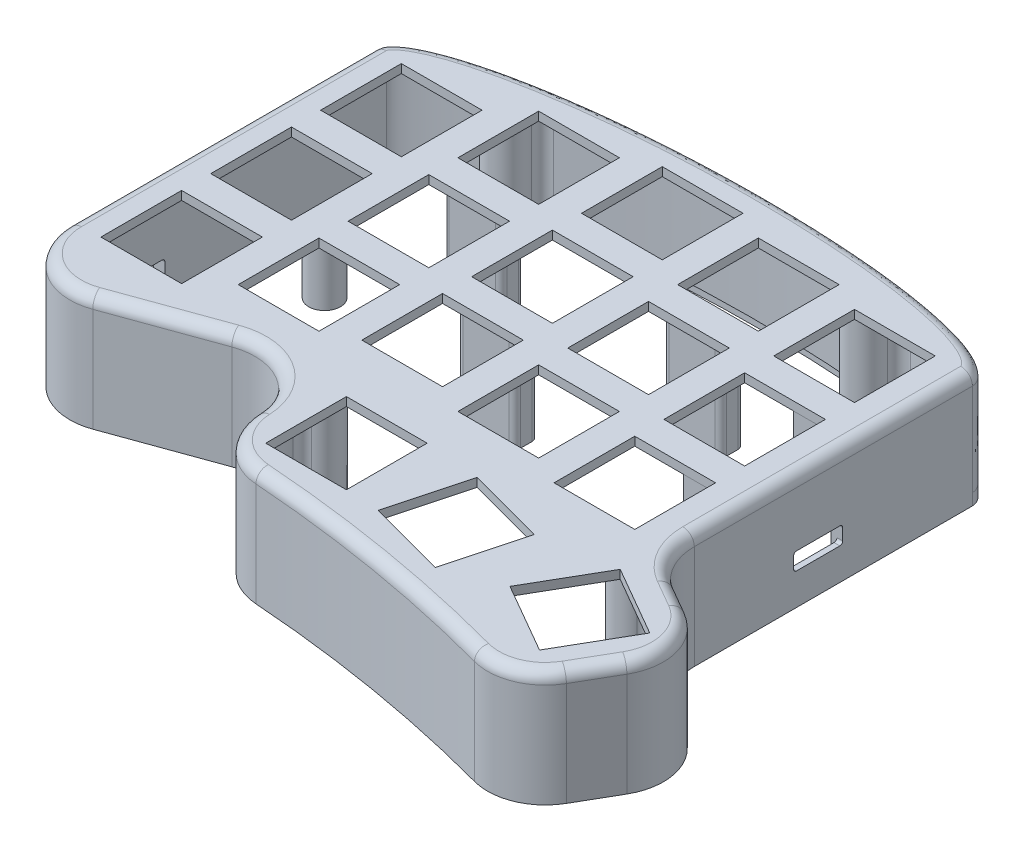
from build123d import *

# Parameters (mm, degrees)
SKETCH2_W           = 14
SKETCH2_H           = 14
BOSS_EXTRUDE1_DEPTH = 18
CUT_EXTRUDE1_START  = -18
CUT_EXTRUDE1_DEPTH  = 16.5
FILLET2_R           = 2
BOSS_EXTRUDE2_START = -18
SKETCH5_R           = 3.25
SKETCH5_R_2         = 1.75
BOSS_EXTRUDE2_DEPTH = 16.5
BOSS_EXTRUDE3_START = -18
BOSS_EXTRUDE3_DEPTH = 2
BOSS_EXTRUDE4_START = -1.5
SKETCH10_R          = 1.75
BOSS_EXTRUDE4_DEPTH = 9.5
SKETCH11_W          = 4.25
SKETCH11_H          = 3
CUT_EXTRUDE6_DEPTH  = 3
CUT_EXTRUDE7_START  = -1
SKETCH11_3_W        = 8.5
SKETCH11_3_H        = 3
CUT_EXTRUDE7_DEPTH  = 3
FILLET4_R           = 0.5
SKETCH12_W          = 8.5
SKETCH12_H          = 3
CUT_EXTRUDE8_DEPTH  = 3
CUT_EXTRUDE9_START  = -1
SKETCH12_3_W        = 8.5
SKETCH12_3_H        = 3.5
CUT_EXTRUDE9_DEPTH  = 3
FILLET5_R           = 0.5


with BuildPart() as part:
    # Sketch2 → Boss-Extrude1 (new body)
    with BuildSketch(Plane(origin=(0, 0, 0), x_dir=(1, 0, 0), z_dir=(0, 1, 0))):
        with BuildLine():
            add(Edge.make_bspline(
                [(-1.5375, 69.612480116), (-1.790942417, 79.920306638), (-52.3875, 78.67627), (-102.984057583, 77.432233362), (-102.730615166, 67.124406841)],
                knots=[0, 0, 0, 1.570796327, 1.570796327, 3.141592654, 3.141592654, 3.141592654], degree=2, weights=[1, 0.707106781, 1, 0.707106781, 1]))
            Line((-102.730615166, 67.124406841), (-102.730615166, 14.278708172))
            ThreePointArc((-102.730615166, 14.278708172), (-98.474805683, 6.093094249), (-89.329760106, 4.874762997))
            Line((-89.329760106, 4.874762997), (-71.623538294, 11.278064263))
            ThreePointArc((-71.623538294, 11.278064263), (-62.662017888, 10.185496887), (-58.232581617, 2.318944544))
            ThreePointArc((-58.232581617, 2.318944544), (-55.406952026, -4.212643161), (-48.952816792, -7.210969177))
            ThreePointArc((-48.952816792, -7.210969177), (-25.961626357, -9.967323639), (-3.342724336, -14.924903587))
            ThreePointArc((-3.342724336, -14.924903587), (3.08385675, -14.514110281), (7.927445634, -10.270368735))
            Line((7.927445634, -10.270368735), (11.767711035, -3.617108928))
            ThreePointArc((11.767711035, -3.617108928), (12.76586328, 3.97119364), (8.105923298, 10.042734064))
            Line((8.105923298, 10.042734064), (3.463472373, 12.722359418))
            ThreePointArc((3.463472373, 12.722359418), (-0.197473334, 16.38268862), (-1.5375, 21.383174783))
            Line((-1.5375, 21.383174783), (-1.5375, 69.612480116))
        make_face()
        with Locations((-45.24248, 4.76377)):
            Rectangle(SKETCH2_W, SKETCH2_H, mode=Mode.SUBTRACT)
        with Locations((-90.4875, 21.43125)):
            Rectangle(SKETCH2_W, SKETCH2_H, mode=Mode.SUBTRACT)
        with Locations((-71.4375, 26.19375)):
            Rectangle(SKETCH2_W, SKETCH2_H, mode=Mode.SUBTRACT)
        with Locations((-52.3875, 28.57627)):
            Rectangle(SKETCH2_W, SKETCH2_H, mode=Mode.SUBTRACT)
        Polygon((-18.864086352, -6.192734043), (-32.386484043, -2.567163648), (-28.760913648, 10.955234043), (-15.238515957, 7.329663648), align=None, mode=Mode.SUBTRACT)
        Polygon((9.561890094, 2.563251416), (2.563251416, -9.561890094), (-9.561890094, -2.563251416), (-2.563251416, 9.561890094), align=None, mode=Mode.SUBTRACT)
        with Locations((-33.3375, 26.19375)):
            Rectangle(SKETCH2_W, SKETCH2_H, mode=Mode.SUBTRACT)
        with Locations((-14.2875, 23.81377)):
            Rectangle(SKETCH2_W, SKETCH2_H, mode=Mode.SUBTRACT)
        with Locations((-90.4875, 40.48125)):
            Rectangle(SKETCH2_W, SKETCH2_H, mode=Mode.SUBTRACT)
        with Locations((-71.4375, 45.24375)):
            Rectangle(SKETCH2_W, SKETCH2_H, mode=Mode.SUBTRACT)
        with Locations((-52.3875, 47.62627)):
            Rectangle(SKETCH2_W, SKETCH2_H, mode=Mode.SUBTRACT)
        with Locations((-90.4875, 59.53125)):
            Rectangle(SKETCH2_W, SKETCH2_H, mode=Mode.SUBTRACT)
        with Locations((-71.4375, 64.29375)):
            Rectangle(SKETCH2_W, SKETCH2_H, mode=Mode.SUBTRACT)
        with Locations((-52.3875, 66.67627)):
            Rectangle(SKETCH2_W, SKETCH2_H, mode=Mode.SUBTRACT)
        with Locations((-33.3375, 45.24375)):
            Rectangle(SKETCH2_W, SKETCH2_H, mode=Mode.SUBTRACT)
        with Locations((-14.2875, 42.86377)):
            Rectangle(SKETCH2_W, SKETCH2_H, mode=Mode.SUBTRACT)
        with Locations((-33.3375, 64.29375)):
            Rectangle(SKETCH2_W, SKETCH2_H, mode=Mode.SUBTRACT)
        with Locations((-14.2875, 61.91377)):
            Rectangle(SKETCH2_W, SKETCH2_H, mode=Mode.SUBTRACT)
    extrude(amount=-BOSS_EXTRUDE1_DEPTH)

    # Sketch3 → Cut-Extrude1 (cut)
    with BuildSketch(Plane(origin=(0, 0, 0), x_dir=(1, 0, 0), z_dir=(0, 1, 0)).offset(CUT_EXTRUDE1_START)):
        with BuildLine():
            Line((-3.5375, 21.383174783), (-3.5375, 69.572252231))
            add(Edge.make_bspline(
                [(-3.5375, 69.572252231), (-3.541173709, 69.606197357), (-3.554301601, 69.637518494), (-3.581974976, 69.69884299), (-3.59790109, 69.728184635), (-3.649208348, 69.813979148), (-3.688170843, 69.868168455), (-3.813161744, 70.025614685), (-3.90522549, 70.121181493), (-4.194279123, 70.393030468), (-4.405585706, 70.554931133), (-5.061372746, 71.006569742), (-5.522514638, 71.25902), (-6.466097746, 71.720662819), (-6.949517754, 71.92786751), (-7.931027893, 72.312482719), (-8.428830807, 72.489345777), (-9.926006799, 72.983364256), (-10.934004841, 73.266597108), (-12.96190189, 73.777521594), (-13.981961729, 74.004462636), (-17.055148449, 74.624581789), (-19.121068571, 74.958054476), (-22.23625013, 75.382185792), (-23.277693249, 75.510435203), (-25.358022073, 75.743722396), (-26.39791203, 75.848886999), (-31.596167021, 76.324738014), (-35.751054647, 76.549982719), (-44.055510634, 76.777995247), (-52.354550241, 76.779469056), (-60.643745607, 76.369209951), (-68.927521195, 75.732270067), (-73.066747928, 75.302501914), (-79.270004826, 74.424333703), (-81.339635416, 74.091664857), (-85.461891203, 73.321364552), (-87.514071488, 72.885141758), (-90.562566461, 72.110499889), (-91.57329427, 71.832096728), (-93.57938348, 71.218232259), (-94.573305027, 70.883949605), (-96.040749334, 70.31553203), (-96.525188662, 70.115027036), (-97.480793406, 69.682916814), (-97.952079847, 69.451604933), (-98.868980609, 68.942188708), (-99.31665083, 68.665028512), (-99.939326788, 68.184144678), (-100.139184116, 68.012869641), (-100.410015865, 67.727114834), (-100.495516055, 67.627114913), (-100.608228775, 67.465419655), (-100.643137924, 67.409749415), (-100.687729415, 67.321804673), (-100.701248617, 67.291904033), (-100.723269859, 67.229917254), (-100.73418758, 67.197643884), (-100.730615166, 67.164634727)],
                knots=[0, 0, 0, 0, 0.000976562, 0.000976562, 0.001953125, 0.001953125, 0.00390625, 0.00390625, 0.0078125, 0.0078125, 0.015625, 0.015625, 0.03125, 0.03125, 0.046875, 0.046875, 0.0625, 0.0625, 0.09375, 0.09375, 0.125, 0.125, 0.1875, 0.1875, 0.21875, 0.21875, 0.25, 0.25, 0.375, 0.375, 0.5, 0.625, 0.625, 0.75, 0.75, 0.8125, 0.8125, 0.875, 0.875, 0.90625, 0.90625, 0.9375, 0.9375, 0.953125, 0.953125, 0.96875, 0.96875, 0.984375, 0.984375, 0.9921875, 0.9921875, 0.99609375, 0.99609375, 0.998046875, 0.998046875, 0.999023438, 0.999023438, 1, 1, 1, 1], degree=3))
            Line((-100.730615166, 67.164634727), (-100.730615166, 14.278708172))
            ThreePointArc((-100.730615166, 14.278708172), (-97.32596758, 7.730217034), (-90.009931118, 6.755552032))
            Line((-90.009931118, 6.755552032), (-72.303709306, 13.158853298))
            ThreePointArc((-72.303709306, 13.158853298), (-61.549884819, 11.847772447), (-56.234561293, 2.407909635))
            ThreePointArc((-56.234561293, 2.407909635), (-53.974057621, -2.817360528), (-48.810749433, -5.216021341))
            ThreePointArc((-48.810749433, -5.216021341), (-25.62810716, -7.99532847), (-2.820853415, -12.994191091))
            ThreePointArc((-2.820853415, -12.994191091), (2.320411453, -12.665556447), (6.195282561, -9.27056321))
            Line((6.195282561, -9.27056321), (10.035547962, -2.617303402))
            ThreePointArc((10.035547962, -2.617303402), (10.834069758, 3.453338652), (7.106117772, 8.310570991))
            Line((7.106117772, 8.310570991), (2.463666847, 10.990196345))
            ThreePointArc((2.463666847, 10.990196345), (-1.929468, 15.382591388), (-3.5375, 21.383174783))
        make_face()
        with BuildLine():
            Line((-75.4375, 52.76875), (-67.4375, 52.76875))
            ThreePointArc((-67.4375, 52.76875), (-66.730393219, 53.061643219), (-66.4375, 53.76875))
            Line((-66.4375, 53.76875), (-66.4375, 55.76875))
            ThreePointArc((-66.4375, 55.76875), (-66.730393219, 56.475856781), (-67.4375, 56.76875))
            Line((-67.4375, 56.76875), (-75.4375, 56.76875))
            ThreePointArc((-75.4375, 56.76875), (-76.144606781, 56.475856781), (-76.4375, 55.76875))
            Line((-76.4375, 55.76875), (-76.4375, 53.76875))
            ThreePointArc((-76.4375, 53.76875), (-76.144606781, 53.061643219), (-75.4375, 52.76875))
        make_face(mode=Mode.SUBTRACT)
        with BuildLine():
            Line((-56.3875, 36.10127), (-48.3875, 36.10127))
            ThreePointArc((-48.3875, 36.10127), (-47.680393219, 36.394163219), (-47.3875, 37.10127))
            Line((-47.3875, 37.10127), (-47.3875, 39.10127))
            ThreePointArc((-47.3875, 39.10127), (-47.680393219, 39.808376781), (-48.3875, 40.10127))
            Line((-48.3875, 40.10127), (-56.3875, 40.10127))
            ThreePointArc((-56.3875, 40.10127), (-57.094606781, 39.808376781), (-57.3875, 39.10127))
            Line((-57.3875, 39.10127), (-57.3875, 37.10127))
            ThreePointArc((-57.3875, 37.10127), (-57.094606781, 36.394163219), (-56.3875, 36.10127))
        make_face(mode=Mode.SUBTRACT)
        with BuildLine():
            Line((-37.3375, 52.76875), (-29.3375, 52.76875))
            ThreePointArc((-29.3375, 52.76875), (-28.630393219, 53.061643219), (-28.3375, 53.76875))
            Line((-28.3375, 53.76875), (-28.3375, 55.76875))
            ThreePointArc((-28.3375, 55.76875), (-28.630393219, 56.475856781), (-29.3375, 56.76875))
            Line((-29.3375, 56.76875), (-37.3375, 56.76875))
            ThreePointArc((-37.3375, 56.76875), (-38.044606781, 56.475856781), (-38.3375, 55.76875))
            Line((-38.3375, 55.76875), (-38.3375, 53.76875))
            ThreePointArc((-38.3375, 53.76875), (-38.044606781, 53.061643219), (-37.3375, 52.76875))
        make_face(mode=Mode.SUBTRACT)
    extrude(amount=CUT_EXTRUDE1_DEPTH, mode=Mode.SUBTRACT)

    # Fillet2
    fillet2_edges = [part.edges().sort_by_distance(p)[0] for p in [
        (-0.197473334, 0, -16.38268862),
        (5.784697835, 0, -11.382546741),
        (12.76586328, 0, -3.97119364),
        (9.847578335, 0, 6.943738831),
        (3.08385675, 0, 14.514110281),
        (-25.961626357, 0, 9.967323639),
        (-55.406952026, 0, 4.212643161),
        (-62.662017888, 0, -10.185496887),
        (-80.4766492, 0, -8.07641363),
        (-98.474805683, 0, -6.093094249),
        (-102.730615166, 0, -40.701557507),
        (-52.3875, 0, -78.67627),
        (-1.5375, 0, -45.49782745),
    ]]
    fillet(fillet2_edges, radius=FILLET2_R)

    # Sketch5 → Boss-Extrude2 (add)
    # profile 1 of 18: a face of its own
    with BuildSketch(Plane(origin=(0, 0, 0), x_dir=(1, 0, 0), z_dir=(0, 1, 0)).offset(BOSS_EXTRUDE2_START)):
        with Locations((-22.5375, 72.139784762)):
            Circle(SKETCH5_R)
        with Locations(Location((-22.5375, 72.139784762, 0), (0, 0, 270))):
            Circle(SKETCH5_R_2, mode=Mode.SUBTRACT)
    # profile 2 of 18: a face of its own
    with BuildSketch(Plane(origin=(0, 0, 0), x_dir=(1, 0, 0), z_dir=(0, 1, 0)).offset(BOSS_EXTRUDE2_START)):
        with BuildLine():
            ThreePointArc((-19.32695492, 72.64466127), (-18.825675207, 74.163836795), (-17.298656746, 74.64069133))
            add(Edge.make_bspline(
                [(-17.298656746, 74.64069133), (-18.593067242, 74.865571139), (-19.893317721, 75.063196036), (-21.505995848, 75.282761825), (-21.814403933, 75.323558959), (-22.122967436, 75.363239858)],
                knots=[0.148240494, 0.148240494, 0.148240494, 0.148240494, 0.1875, 0.1875, 0.196773323, 0.196773323, 0.196773323, 0.196773323], degree=3))
            ThreePointArc((-22.122967436, 75.363239858), (-20.271895364, 74.46992116), (-19.32695492, 72.64466127))
        make_face()
    # profile 3 of 18: a face of its own
    with BuildSketch(Plane(origin=(0, 0, 0), x_dir=(1, 0, 0), z_dir=(0, 1, 0)).offset(BOSS_EXTRUDE2_START)):
        with BuildLine():
            ThreePointArc((-25.51147163, 73.450506985), (-24.135097836, 74.970011106), (-22.122967436, 75.363239858))
            add(Edge.make_bspline(
                [(-22.122967436, 75.363239858), (-22.854226388, 75.457278888), (-23.586358227, 75.545048763), (-25.19477661, 75.725416119), (-26.071500491, 75.81559478), (-26.948050573, 75.898504353)],
                knots=[0.196773323, 0.196773323, 0.196773323, 0.196773323, 0.21875, 0.21875, 0.245095563, 0.245095563, 0.245095563, 0.245095563], degree=3))
            ThreePointArc((-26.948050573, 75.898504353), (-25.818452477, 75.334014883), (-25.362840985, 74.156280452))
            ThreePointArc((-25.362840985, 74.156280452), (-25.400401735, 73.795653479), (-25.51147163, 73.450506985))
        make_face()
    # profile 4 of 18: a face of its own
    with BuildSketch(Plane(origin=(0, 0, 0), x_dir=(1, 0, 0), z_dir=(0, 1, 0)).offset(BOSS_EXTRUDE2_START)):
        with Locations((-83.230615166, 70.431268908)):
            Circle(SKETCH5_R)
        with Locations(Location((-83.230615166, 70.431268908, 0), (0, 0, 270))):
            Circle(SKETCH5_R_2, mode=Mode.SUBTRACT)
    # profile 5 of 18: a face of its own
    with BuildSketch(Plane(origin=(0, 0, 0), x_dir=(1, 0, 0), z_dir=(0, 1, 0)).offset(BOSS_EXTRUDE2_START)):
        with BuildLine():
            add(Edge.make_bspline(
                [(-83.839020957, 73.623813723), (-85.440297336, 73.318657168), (-87.035699178, 72.98138718), (-88.620104302, 72.598317068)],
                knots=[0.816931195, 0.816931195, 0.816931195, 0.816931195, 0.865518224, 0.865518224, 0.865518224, 0.865518224], degree=3))
            ThreePointArc((-88.620104302, 72.598317068), (-87.126534585, 72.272499833), (-86.458846766, 70.897326992))
            ThreePointArc((-86.458846766, 70.897326992), (-86.460752534, 70.815677999), (-86.466465689, 70.73420684))
            ThreePointArc((-86.466465689, 70.73420684), (-85.635201125, 72.617696671), (-83.839020957, 73.623813723))
        make_face()
    # profile 6 of 18: a face of its own
    with BuildSketch(Plane(origin=(0, 0, 0), x_dir=(1, 0, 0), z_dir=(0, 1, 0)).offset(BOSS_EXTRUDE2_START)):
        with BuildLine():
            add(Edge.make_bspline(
                [(-79.048332746, 74.444805628), (-80.500939652, 74.221707486), (-81.952949176, 73.977058728), (-83.546895464, 73.679207897), (-83.692982641, 73.651644364), (-83.839020957, 73.623813723)],
                knots=[0.768597638, 0.768597638, 0.768597638, 0.768597638, 0.8125, 0.8125, 0.816931195, 0.816931195, 0.816931195, 0.816931195], degree=3))
            ThreePointArc((-83.839020957, 73.623813723), (-81.80509341, 73.351951657), (-80.339454109, 71.915751222))
            ThreePointArc((-80.339454109, 71.915751222), (-80.3413115, 73.510795358), (-79.048332746, 74.444805628))
        make_face()
    # profile 7 of 18: a face of its own
    with BuildSketch(Plane(origin=(0, 0, 0), x_dir=(1, 0, 0), z_dir=(0, 1, 0)).offset(BOSS_EXTRUDE2_START)):
        with Locations((-93.230615166, 9.555097265)):
            Circle(SKETCH5_R)
        with Locations(Location((-93.230615166, 9.555097265, 0), (0, 0, 270))):
            Circle(SKETCH5_R_2, mode=Mode.SUBTRACT)
    # profile 8 of 18: a face of its own
    with BuildSketch(Plane(origin=(0, 0, 0), x_dir=(1, 0, 0), z_dir=(0, 1, 0)).offset(BOSS_EXTRUDE2_START)):
        with BuildLine():
            ThreePointArc((-96.349172674, 10.470028447), (-97.789489932, 9.229067802), (-99.511774589, 10.03419679))
            ThreePointArc((-99.511774589, 10.03419679), (-96.969896133, 7.494277696), (-93.572720546, 6.323152973))
            ThreePointArc((-93.572720546, 6.323152973), (-95.931206019, 7.746974193), (-96.349172674, 10.470028447))
        make_face()
    # profile 9 of 18: a face of its own
    with BuildSketch(Plane(origin=(0, 0, 0), x_dir=(1, 0, 0), z_dir=(0, 1, 0)).offset(BOSS_EXTRUDE2_START)):
        with BuildLine():
            ThreePointArc((-89.986407024, 9.361155177), (-91.129921362, 7.075261476), (-93.572720546, 6.323152973))
            ThreePointArc((-93.572720546, 6.323152973), (-91.766765235, 6.33698334), (-90.009931118, 6.755552032))
            Line((-90.009931118, 6.755552032), (-87.644376011, 7.611034482))
            ThreePointArc((-87.644376011, 7.611034482), (-89.287071435, 7.85488751), (-89.986407024, 9.361155177))
        make_face()
    # profile 10 of 18: a face of its own
    with BuildSketch(Plane(origin=(0, 0, 0), x_dir=(1, 0, 0), z_dir=(0, 1, 0)).offset(BOSS_EXTRUDE2_START)):
        with Locations((-58.730615166, 13.809911638)):
            Circle(SKETCH5_R)
        with Locations(Location((-58.730615166, 13.809911638, 0), (0, 0, 270))):
            Circle(SKETCH5_R_2, mode=Mode.SUBTRACT)
    # profile 11 of 18: a face of its own
    with BuildSketch(Plane(origin=(0, 0, 0), x_dir=(1, 0, 0), z_dir=(0, 1, 0)).offset(BOSS_EXTRUDE2_START)):
        with BuildLine():
            ThreePointArc((-61.911902321, 14.474676286), (-62.767656013, 13.306970211), (-64.210075119, 13.183362038))
            ThreePointArc((-64.210075119, 13.183362038), (-62.402317463, 12.368086036), (-60.753514915, 11.266218141))
            ThreePointArc((-60.753514915, 11.266218141), (-61.787483048, 12.706254648), (-61.911902321, 14.474676286))
        make_face()
    # profile 12 of 18: a face of its own
    with BuildSketch(Plane(origin=(0, 0, 0), x_dir=(1, 0, 0), z_dir=(0, 1, 0)).offset(BOSS_EXTRUDE2_START)):
        with BuildLine():
            ThreePointArc((-57.366621672, 10.859992698), (-59.117647646, 10.58303918), (-60.753514915, 11.266218141))
            ThreePointArc((-60.753514915, 11.266218141), (-59.308696539, 9.90785055), (-58.107320542, 8.33008049))
            ThreePointArc((-58.107320542, 8.33008049), (-58.311661576, 9.763292465), (-57.366621672, 10.859992698))
        make_face()
    # profile 13 of 18: a face of its own
    with BuildSketch(Plane(origin=(0, 0, 0), x_dir=(1, 0, 0), z_dir=(0, 1, 0)).offset(BOSS_EXTRUDE2_START)):
        with Locations((-9.5375, -7.940565221)):
            Circle(SKETCH5_R)
        with Locations(Location((-9.5375, -7.940565221, 0), (0, 0, 270))):
            Circle(SKETCH5_R_2, mode=Mode.SUBTRACT)
    # profile 14 of 18: a face of its own
    with BuildSketch(Plane(origin=(0, 0, 0), x_dir=(1, 0, 0), z_dir=(0, 1, 0)).offset(BOSS_EXTRUDE2_START)):
        with BuildLine():
            ThreePointArc((-14.890028469, -10.061820536), (-12.585159842, -10.571363622), (-10.285367198, -11.10334796))
            ThreePointArc((-10.285367198, -11.10334796), (-12.001292852, -10.060052136), (-12.776518013, -8.207515233))
            ThreePointArc((-12.776518013, -8.207515233), (-12.772083611, -8.279325555), (-12.770604643, -8.35125746))
            ThreePointArc((-12.770604643, -8.35125746), (-13.421512221, -9.713056215), (-14.890028469, -10.061820536))
        make_face()
    # profile 15 of 18: a face of its own
    with BuildSketch(Plane(origin=(0, 0, 0), x_dir=(1, 0, 0), z_dir=(0, 1, 0)).offset(BOSS_EXTRUDE2_START)):
        with BuildLine():
            ThreePointArc((-10.285367198, -11.10334796), (-7.990868892, -11.657723044), (-5.701883052, -12.234436173))
            ThreePointArc((-5.701883052, -12.234436173), (-6.887142436, -11.198819736), (-6.761066995, -9.629920059))
            ThreePointArc((-6.761066995, -9.629920059), (-8.283898288, -10.939061969), (-10.285367198, -11.10334796))
        make_face()
    # profile 16 of 18: a face of its own
    with BuildSketch(Plane(origin=(0, 0, 0), x_dir=(1, 0, 0), z_dir=(0, 1, 0)).offset(BOSS_EXTRUDE2_START)):
        with Locations((-4.7375, 13.746257866)):
            Circle(SKETCH5_R)
        with Locations(Location((-4.7375, 13.746257866, 0), (0, 0, 270))):
            Circle(SKETCH5_R_2, mode=Mode.SUBTRACT)
    # profile 17 of 18: a face of its own
    with BuildSketch(Plane(origin=(0, 0, 0), x_dir=(1, 0, 0), z_dir=(0, 1, 0)).offset(BOSS_EXTRUDE2_START)):
        with BuildLine():
            ThreePointArc((-1.92438532, 15.373797664), (-2.772252313, 17.166500682), (-3.313296461, 19.074361731))
            ThreePointArc((-3.313296461, 19.074361731), (-3.288793361, 18.906802624), (-3.280600088, 18.737659707))
            ThreePointArc((-3.280600088, 18.737659707), (-3.757410428, 17.537039829), (-4.928015048, 16.990669063))
            ThreePointArc((-4.928015048, 16.990669063), (-3.19702102, 16.607974922), (-1.92438532, 15.373797664))
        make_face()
    # profile 18 of 18: a face of its own
    with BuildSketch(Plane(origin=(0, 0, 0), x_dir=(1, 0, 0), z_dir=(0, 1, 0)).offset(BOSS_EXTRUDE2_START)):
        with BuildLine():
            ThreePointArc((0.591448843, 12.325219512), (-0.792850792, 13.745211591), (-1.92438532, 15.373797664))
            ThreePointArc((-1.92438532, 15.373797664), (-1.598621003, 14.588836434), (-1.4875, 13.746257866))
            ThreePointArc((-1.4875, 13.746257866), (-1.62341533, 12.816216646), (-2.019793335, 11.963964264))
            ThreePointArc((-2.019793335, 11.963964264), (-0.796234366, 12.737757161), (0.591448843, 12.325219512))
        make_face()
    extrude(amount=BOSS_EXTRUDE2_DEPTH)

    # Sketch6 → Boss-Extrude3 (add)
    with BuildSketch(Plane(origin=(0, 0, 0), x_dir=(1, 0, 0), z_dir=(0, 1, 0)).offset(BOSS_EXTRUDE3_START)):
        with BuildLine():
            Line((-1.5375, 21.383174783), (-1.5375, 69.612480116))
            add(Edge.make_bspline(
                [(-1.5375, 69.612480116), (-1.790942417, 79.920306638), (-52.3875, 78.67627), (-102.984057583, 77.432233362), (-102.730615166, 67.124406841)],
                knots=[3.141592654, 3.141592654, 3.141592654, 4.71238898, 4.71238898, 6.283185307, 6.283185307, 6.283185307], degree=2, weights=[1, 0.707106781, 1, 0.707106781, 1]))
            Line((-102.730615166, 67.124406841), (-102.730615166, 14.278708172))
            ThreePointArc((-102.730615166, 14.278708172), (-98.474805683, 6.093094249), (-89.329760106, 4.874762997))
            Line((-89.329760106, 4.874762997), (-71.623538294, 11.278064263))
            ThreePointArc((-71.623538294, 11.278064263), (-62.662017888, 10.185496887), (-58.232581617, 2.318944544))
            ThreePointArc((-58.232581617, 2.318944544), (-55.406952026, -4.212643161), (-48.952816792, -7.210969177))
            ThreePointArc((-48.952816792, -7.210969177), (-25.961626357, -9.967323639), (-3.342724336, -14.924903587))
            ThreePointArc((-3.342724336, -14.924903587), (3.08385675, -14.514110281), (7.927445634, -10.270368735))
            Line((7.927445634, -10.270368735), (11.767711035, -3.617108928))
            ThreePointArc((11.767711035, -3.617108928), (12.76586328, 3.97119364), (8.105923298, 10.042734064))
            Line((8.105923298, 10.042734064), (3.463472373, 12.722359418))
            ThreePointArc((3.463472373, 12.722359418), (-0.197473334, 16.38268862), (-1.5375, 21.383174783))
        make_face()
        with BuildLine():
            Line((-2.5375, 21.383174783), (-2.5375, 69.598218788))
            add(Edge.make_bspline(
                [(-2.5375, 69.598218788), (-2.546954708, 69.876509698), (-2.663759238, 70.135173542), (-2.891265175, 70.476633482), (-2.977470232, 70.584971563), (-3.160158936, 70.789437239), (-3.256558964, 70.885596087), (-3.556445051, 71.161234247), (-3.770440702, 71.328087125), (-4.215675375, 71.641076345), (-4.447748092, 71.787245869), (-5.152330354, 72.197426437), (-5.636459764, 72.436424079), (-6.620981384, 72.875527364), (-7.121659224, 73.074949932), (-8.640851682, 73.63218254), (-9.679226408, 73.950405555), (-11.76337701, 74.518387043), (-12.810643947, 74.767871486), (-15.962972556, 75.446351614), (-18.078385438, 75.806547795), (-22.325886522, 76.416107346), (-24.458229251, 76.663778997), (-28.735526018, 77.075301003), (-30.881566022, 77.238782186), (-35.179515146, 77.496024517), (-37.328917876, 77.5895358), (-43.778248843, 77.778001783), (-48.079283608, 77.782221024), (-56.684044098, 77.570000099), (-60.985265325, 77.35347005), (-69.565842948, 76.677808339), (-73.849740033, 76.220505361), (-80.23840048, 75.28499058), (-82.363129011, 74.930812273), (-86.588446512, 74.108153002), (-88.691987496, 73.64074601), (-91.810189071, 72.803249694), (-92.84420924, 72.500797549), (-94.889908109, 71.8297132), (-95.903014167, 71.461712841), (-97.388248328, 70.828061244), (-97.877227791, 70.60318759), (-98.836934468, 70.112892412), (-99.306020246, 69.849053581), (-99.981555205, 69.4045279), (-100.200752158, 69.248864107), (-100.621626657, 68.91640552), (-100.823600333, 68.73987033), (-101.199050454, 68.35209953), (-101.372266606, 68.142605821), (-101.575943762, 67.790415694), (-101.633067165, 67.668568345), (-101.713390966, 67.410853841), (-101.735250856, 67.275115571), (-101.730615166, 67.138668169)],
                knots=[0, 0, 0, 0, 0.0078125, 0.0078125, 0.01171875, 0.01171875, 0.015625, 0.015625, 0.0234375, 0.0234375, 0.03125, 0.03125, 0.046875, 0.046875, 0.0625, 0.0625, 0.09375, 0.09375, 0.125, 0.125, 0.1875, 0.1875, 0.25, 0.25, 0.3125, 0.3125, 0.375, 0.375, 0.5, 0.5, 0.625, 0.625, 0.75, 0.75, 0.8125, 0.8125, 0.875, 0.875, 0.90625, 0.90625, 0.9375, 0.9375, 0.953125, 0.953125, 0.96875, 0.96875, 0.9765625, 0.9765625, 0.984375, 0.984375, 0.9921875, 0.9921875, 0.99609375, 0.99609375, 1, 1, 1, 1], degree=3))
            Line((-101.730615166, 67.138668169), (-101.730615166, 14.278708172))
            ThreePointArc((-101.730615166, 14.278708172), (-97.900386631, 6.911655641), (-89.669845612, 5.815157515))
            Line((-89.669845612, 5.815157515), (-71.9636238, 12.218458781))
            ThreePointArc((-71.9636238, 12.218458781), (-62.105951354, 11.016634667), (-57.233571455, 2.36342709))
            ThreePointArc((-57.233571455, 2.36342709), (-54.690504824, -3.515001844), (-48.881783112, -6.213495259))
            ThreePointArc((-48.881783112, -6.213495259), (-25.794866758, -8.981326054), (-3.081788876, -13.959547339))
            ThreePointArc((-3.081788876, -13.959547339), (2.702134101, -13.589833364), (7.061364098, -9.770465972))
            Line((7.061364098, -9.770465972), (10.901629499, -3.117206165))
            ThreePointArc((10.901629499, -3.117206165), (11.799966519, 3.712266146), (7.606020535, 9.176652528))
            Line((7.606020535, 9.176652528), (2.96356961, 11.856277882))
            ThreePointArc((2.96356961, 11.856277882), (-1.063470667, 15.882640004), (-2.5375, 21.383174783))
        make_face(mode=Mode.SUBTRACT)
    extrude(amount=-BOSS_EXTRUDE3_DEPTH)

    # Sketch11 → Cut-Extrude6 (cut)
    with BuildSketch(Plane.ZY.offset(102.730615166)):
        with Locations((-26.636606841, -13.5)):
            Rectangle(SKETCH11_W, SKETCH11_H)
        with Locations((-22.386606841, -13.5)):
            Rectangle(SKETCH11_W, SKETCH11_H)
    extrude(amount=-CUT_EXTRUDE6_DEPTH, mode=Mode.SUBTRACT)

    # Sketch11<3> → Cut-Extrude7 (cut)
    with BuildSketch(Plane.ZY.offset(102.730615166).offset(CUT_EXTRUDE7_START)):
        with Locations((-24.511606841, -16.5)):
            Rectangle(SKETCH11_3_W, SKETCH11_3_H)
    extrude(amount=-CUT_EXTRUDE7_DEPTH, mode=Mode.SUBTRACT)

    # Fillet4
    fillet4_edges = [part.edges().sort_by_distance(p)[0] for p in [
        (-101.730615166, -12, -28.761606841),
        (-101.730615166, -12, -20.261606841),
        (-102.230615166, -15, -20.261606841),
        (-102.230615166, -15, -28.761606841),
        (-101.230615166, -18, -20.261606841),
        (-101.230615166, -18, -28.761606841),
    ]]
    fillet(fillet4_edges, radius=FILLET4_R)

    # Sketch12 → Cut-Extrude8 (cut)
    with BuildSketch(Plane(origin=(-1.5375, 0, 0), x_dir=(0, 0, -1), z_dir=(1, 0, 0))):
        with Locations((42.863780116, -13)):
            Rectangle(SKETCH12_W, SKETCH12_H)
    extrude(amount=-CUT_EXTRUDE8_DEPTH, mode=Mode.SUBTRACT)

    # Sketch12<3> → Cut-Extrude9 (cut)
    with BuildSketch(Plane(origin=(-1.5375, 0, 0), x_dir=(0, 0, -1), z_dir=(1, 0, 0)).offset(CUT_EXTRUDE9_START)):
        with Locations((42.863780116, -16.25)):
            Rectangle(SKETCH12_3_W, SKETCH12_3_H)
    extrude(amount=-CUT_EXTRUDE9_DEPTH, mode=Mode.SUBTRACT)

    # Fillet5
    fillet5_edges = [part.edges().sort_by_distance(p)[0] for p in [
        (-2.5375, -11.5, -47.113780116),
        (-2.5375, -11.5, -38.613780116),
        (-2.0375, -14.5, -38.613780116),
        (-2.0375, -14.5, -47.113780116),
        (-3.0375, -18, -47.113780116),
        (-3.0375, -18, -38.613780116),
    ]]
    fillet(fillet5_edges, radius=FILLET5_R)


with BuildPart() as body_2:
    # Sketch10 → Boss-Extrude4 (new body)
    # profile 1 of 6: a face of its own
    with BuildSketch(Plane(origin=(0, 0, 0), x_dir=(1, 0, 0), z_dir=(0, 1, 0)).offset(BOSS_EXTRUDE4_START)):
        with BuildLine():
            ThreePointArc((-7.5375, 52.38877), (-7.853850158, 53.787411699), (-8.741314525, 54.91377))
            Line((-8.741314525, 54.91377), (-12.833685475, 54.91377))
            ThreePointArc((-12.833685475, 54.91377), (-14.0375, 52.38877), (-12.833685475, 49.86377))
            Line((-12.833685475, 49.86377), (-8.741314525, 49.86377))
            ThreePointArc((-8.741314525, 49.86377), (-7.853850158, 50.990128301), (-7.5375, 52.38877))
        make_face()
        with Locations(Location((-10.7875, 52.38877, 0), (0, 0, 270))):
            Circle(SKETCH10_R, mode=Mode.SUBTRACT)
    # profile 2 of 6: a face of its own
    with BuildSketch(Plane(origin=(0, 0, 0), x_dir=(1, 0, 0), z_dir=(0, 1, 0)).offset(BOSS_EXTRUDE4_START)):
        with BuildLine():
            Line((-12.833685475, 30.81377), (-8.741314525, 30.81377))
            ThreePointArc((-8.741314525, 30.81377), (-7.853850158, 31.940128301), (-7.5375, 33.33877))
            ThreePointArc((-7.5375, 33.33877), (-7.853850158, 34.737411699), (-8.741314525, 35.86377))
            Line((-8.741314525, 35.86377), (-12.833685475, 35.86377))
            ThreePointArc((-12.833685475, 35.86377), (-14.0375, 33.33877), (-12.833685475, 30.81377))
        make_face()
        with Locations(Location((-10.7875, 33.33877, 0), (0, 0, 270))):
            Circle(SKETCH10_R, mode=Mode.SUBTRACT)
    # profile 3 of 6: a face of its own
    with BuildSketch(Plane(origin=(0, 0, 0), x_dir=(1, 0, 0), z_dir=(0, 1, 0)).offset(BOSS_EXTRUDE4_START)):
        with BuildLine():
            ThreePointArc((-77.2375, 35.71875), (-81.222704836, 38.175733723), (-81.627877465, 33.511565873))
            Line((-81.627877465, 33.511565873), (-78.347122535, 33.511565873))
            ThreePointArc((-78.347122535, 33.511565873), (-77.530516277, 34.483545164), (-77.2375, 35.71875))
        make_face()
        with Locations(Location((-79.9875, 35.71875, 0), (0, 0, 270))):
            Circle(SKETCH10_R, mode=Mode.SUBTRACT)
    # profile 4 of 6: a face of its own
    with BuildSketch(Plane(origin=(0, 0, 0), x_dir=(1, 0, 0), z_dir=(0, 1, 0)).offset(BOSS_EXTRUDE4_START)):
        with BuildLine():
            Line((-78.347122535, 33.511565873), (-81.627877465, 33.511565873))
            ThreePointArc((-81.627877465, 33.511565873), (-79.9875, 32.96875), (-78.347122535, 33.511565873))
        make_face()
    # profile 5 of 6: a face of its own
    with BuildSketch(Plane(origin=(0, 0, 0), x_dir=(1, 0, 0), z_dir=(0, 1, 0)).offset(BOSS_EXTRUDE4_START)):
        with BuildLine():
            ThreePointArc((-81.627877465, 15.511565873), (-82.409929295, 12.002715002), (-79.052265037, 10.718296757))
            ThreePointArc((-79.052265037, 10.718296757), (-77.736456226, 11.724729275), (-77.2375, 13.304381745))
            ThreePointArc((-77.2375, 13.304381745), (-77.530516277, 14.539586581), (-78.347122535, 15.511565873))
            Line((-78.347122535, 15.511565873), (-81.627877465, 15.511565873))
        make_face()
        with Locations(Location((-79.9875, 13.304381745, 0), (0, 0, 270))):
            Circle(SKETCH10_R, mode=Mode.SUBTRACT)
    # profile 6 of 6: a face of its own
    with BuildSketch(Plane(origin=(0, 0, 0), x_dir=(1, 0, 0), z_dir=(0, 1, 0)).offset(BOSS_EXTRUDE4_START)):
        with BuildLine():
            ThreePointArc((-78.347122535, 15.511565873), (-79.9875, 16.054381745), (-81.627877465, 15.511565873))
            Line((-81.627877465, 15.511565873), (-78.347122535, 15.511565873))
        make_face()
    extrude(amount=-BOSS_EXTRUDE4_DEPTH)


solid = Compound([part.part, body_2.part])
